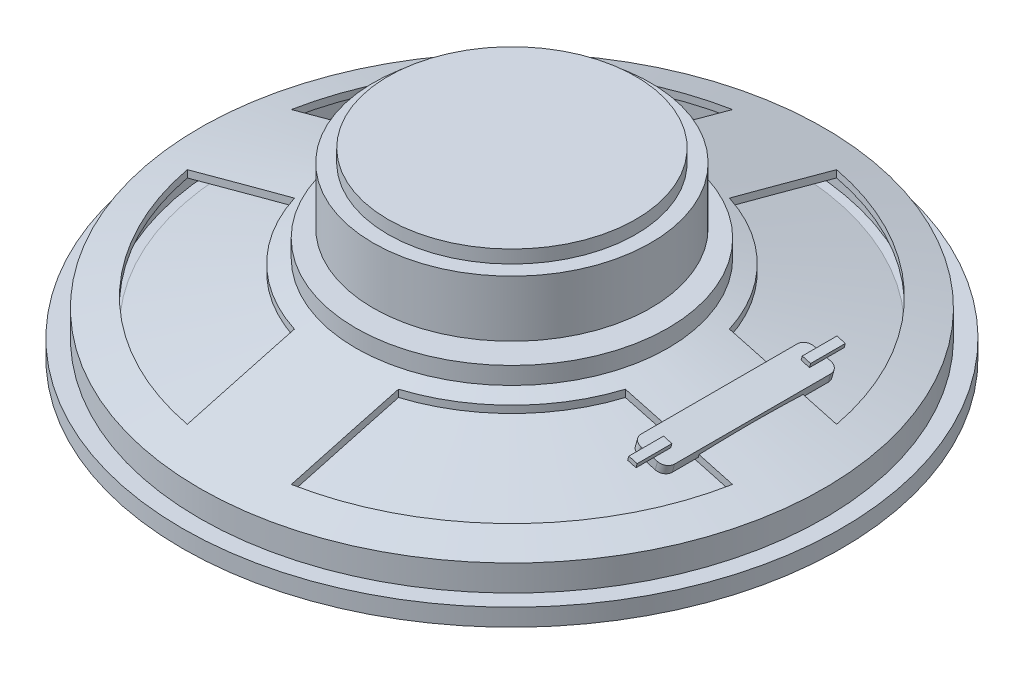
from build123d import *

# Parameters (mm, degrees)
ESQUISSE2_W             = 1.7125
ESQUISSE2_H             = 1.5
ENL_V_MAT_EXTRU_2_REACH = 59.697
BOSS_EXTRU_2_DEPTH      = 0.5
ESQUISSE5_W             = 1
ESQUISSE5_H             = 4
BOSS_EXTRU_3_DEPTH      = 0.5


with BuildPart() as part:
    # Esquisse1 → Base-Révolution (revolve)
    with BuildSketch(Plane.XY, mode=Mode.PRIVATE) as base_r_volution_sk:
        with BuildLine():
            Line((0, 0), (-16, 0))
            Line((-16, 0), (-16, -8))
            Line((-16, -8), (-10, -8))
            Line((-10, -8), (-10, -9))
            Line((-10, -9), (-18, -9))
            Line((-18, -9), (-18, -11))
            Line((-18, -11), (-36, -16))
            Line((-36, -16), (-36, -19))
            Line((-36, -19), (-38, -19))
            Line((-38, -19), (-38, -21))
            Line((-38, -21), (-32, -21))
            Line((-32, -21), (-32, -19))
            Line((-32, -19), (-30, -19))
            Line((-30, -19), (-30, -21))
            Line((-30, -21), (-10, -16))
            ThreePointArc((-10, -16), (-5.360654987, -18.865907042), (0, -19.866068747))
            Line((0, -19.866068747), (0, 0))
        make_face()
    revolve(base_r_volution_sk.sketch.rotate(Axis((0, 70, 0), (0, -1, 0)), 270), axis=Axis((0, 70, 0), (0, -1, 0)))

    # Esquisse2 → Enlèvement de matière-Révolution1 (revolve, cut)
    with BuildSketch(Plane.XY, mode=Mode.PRIVATE) as enl_vement_de_mati_re_r_volution1_sk:
        Polygon((-33.010953329, -16), (-15.010953329, -11), (-5.3, -11), (-5.3, -11.325), (-32, -18), (-33.010953329, -18), align=None)
        with Locations((-15.14375, -0.75)):
            Rectangle(ESQUISSE2_W, ESQUISSE2_H)
    revolve(enl_vement_de_mati_re_r_volution1_sk.sketch.rotate(Axis((0, 0, 0), (0, -1, 0)), 270), axis=Axis((0, 0, 0), (0, -1, 0)), mode=Mode.SUBTRACT)

    # Esquisse3 → Enlèv. mat.-Extru.2 (cut, up to next)
    with BuildSketch(Plane(origin=(0, 0, 0), x_dir=(1, 0, 0), z_dir=(0, 1, 0)), mode=Mode.PRIVATE) as enl_v_mat_extru_2_sk1:
        with BuildLine():
            Line((6, 19.078784028), (6, 31.432467291))
            ThreePointArc((6, 31.432467291), (22.627416998, 22.627416998), (31.432467291, 6))
            Line((31.432467291, 6), (19.078784028, 6))
            ThreePointArc((19.078784028, 6), (14.142135624, 14.142135624), (6, 19.078784028))
        make_face()
    enl_v_mat_extru_2_tool1 = extrude(enl_v_mat_extru_2_sk1.sketch, amount=-ENL_V_MAT_EXTRU_2_REACH, mode=Mode.PRIVATE) & part.part
    # Esquisse3 → Enlèv. mat.-Extru.2 (cut, up to next)
    with BuildSketch(Plane(origin=(0, 0, 0), x_dir=(1, 0, 0), z_dir=(0, 1, 0)), mode=Mode.PRIVATE) as enl_v_mat_extru_2_sk2:
        with BuildLine():
            Line((-6, 19.078784028), (-6, 31.432467291))
            ThreePointArc((-6, 31.432467291), (-22.627416998, 22.627416998), (-31.432467291, 6))
            Line((-31.432467291, 6), (-19.078784028, 6))
            ThreePointArc((-19.078784028, 6), (-14.142135624, 14.142135624), (-6, 19.078784028))
        make_face()
    enl_v_mat_extru_2_tool2 = extrude(enl_v_mat_extru_2_sk2.sketch, amount=-ENL_V_MAT_EXTRU_2_REACH, mode=Mode.PRIVATE) & part.part
    # Esquisse3 → Enlèv. mat.-Extru.2 (cut, up to next)
    with BuildSketch(Plane(origin=(0, 0, 0), x_dir=(1, 0, 0), z_dir=(0, 1, 0)), mode=Mode.PRIVATE) as enl_v_mat_extru_2_sk3:
        with BuildLine():
            Line((-19.078784028, -6), (-31.432467291, -6))
            ThreePointArc((-31.432467291, -6), (-22.627416998, -22.627416998), (-6, -31.432467291))
            Line((-6, -31.432467291), (-6, -19.078784028))
            ThreePointArc((-6, -19.078784028), (-14.142135624, -14.142135624), (-19.078784028, -6))
        make_face()
    enl_v_mat_extru_2_tool3 = extrude(enl_v_mat_extru_2_sk3.sketch, amount=-ENL_V_MAT_EXTRU_2_REACH, mode=Mode.PRIVATE) & part.part
    # Esquisse3 → Enlèv. mat.-Extru.2 (cut, up to next)
    with BuildSketch(Plane(origin=(0, 0, 0), x_dir=(1, 0, 0), z_dir=(0, 1, 0)), mode=Mode.PRIVATE) as enl_v_mat_extru_2_sk4:
        with BuildLine():
            Line((6, -19.078784028), (6, -31.432467291))
            ThreePointArc((6, -31.432467291), (22.627416998, -22.627416998), (31.432467291, -6))
            Line((31.432467291, -6), (19.078784028, -6))
            ThreePointArc((19.078784028, -6), (14.142135624, -14.142135624), (6, -19.078784028))
        make_face()
    enl_v_mat_extru_2_tool4 = extrude(enl_v_mat_extru_2_sk4.sketch, amount=-ENL_V_MAT_EXTRU_2_REACH, mode=Mode.PRIVATE) & part.part
    add(enl_v_mat_extru_2_tool1.solids().sort_by_distance((17.884719, 0, -17.884719))[0], mode=Mode.SUBTRACT)
    add(enl_v_mat_extru_2_tool2.solids().sort_by_distance((-17.884719, 0, -17.884719))[0], mode=Mode.SUBTRACT)
    add(enl_v_mat_extru_2_tool3.solids().sort_by_distance((-17.884719, 0, 17.884719))[0], mode=Mode.SUBTRACT)
    add(enl_v_mat_extru_2_tool4.solids().sort_by_distance((17.884719, 0, 17.884719))[0], mode=Mode.SUBTRACT)

    # Esquisse4 → Boss.-Extru.2 (add, symmetric)
    with BuildSketch(Plane(origin=(27, -13.5, 0), x_dir=(0, 0, -1), z_dir=(0.26764386378609417, 0.9635179096299408, 0))):
        with BuildLine():
            Line((-9, 3.357510793), (9, 3.357510793))
            ThreePointArc((9, 3.357510793), (9.707106781, 3.064617574), (10, 2.357510793))
            Line((10, 2.357510793), (10, 0.357510793))
            ThreePointArc((10, 0.357510793), (9.707106781, -0.349595989), (9, -0.642489207))
            Line((9, -0.642489207), (-9, -0.642489207))
            ThreePointArc((-9, -0.642489207), (-9.707106781, -0.349595989), (-10, 0.357510793))
            Line((-10, 0.357510793), (-10, 2.357510793))
            ThreePointArc((-10, 2.357510793), (-9.707106781, 3.064617574), (-9, 3.357510793))
        make_face()
    extrude(amount=BOSS_EXTRU_2_DEPTH, both=True)

    # Esquisse5 → Boss.-Extru.3 (add)
    with BuildSketch(Plane(origin=(-1.413456005, -5.088441618, 0), x_dir=(-0.9635179096299408, 0.26764386378609417, 0), z_dir=(0.26764386378609417, 0.9635179096299408, 0))):
        with Locations((-28.270664928, 10)):
            Rectangle(ESQUISSE5_W, ESQUISSE5_H)
        with Locations((-28.270664928, -10)):
            Rectangle(ESQUISSE5_W, ESQUISSE5_H)
    extrude(amount=BOSS_EXTRU_3_DEPTH)


solid = part.part
